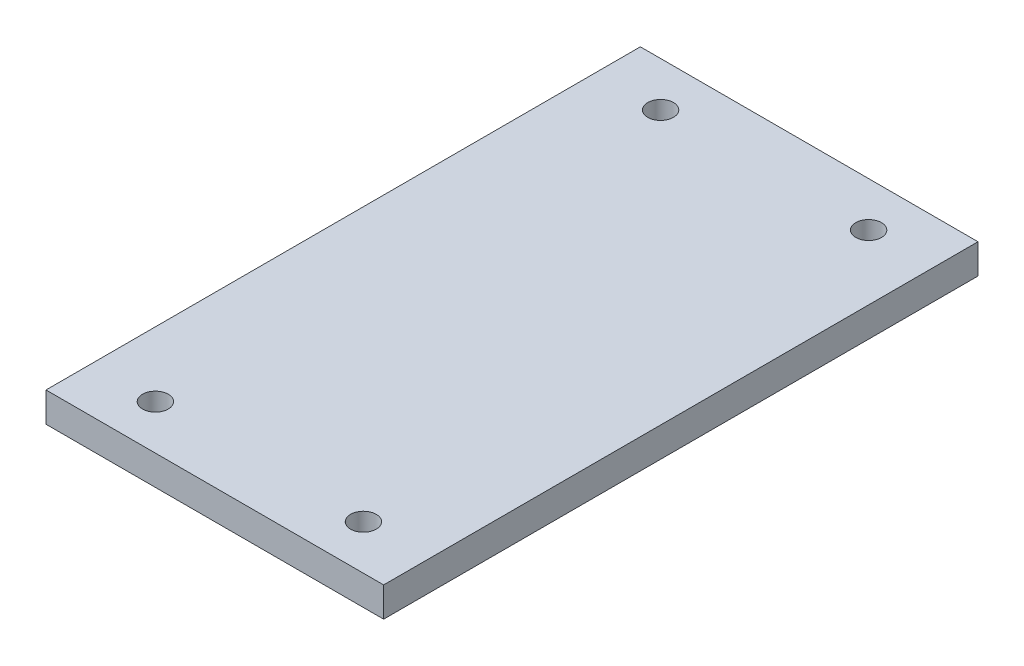
from build123d import *

# Parameters (mm, degrees)
SKETCH2_W           = 72.143718552
SKETCH2_H           = 127
BOSS_EXTRUDE1_DEPTH = 6.35
SKETCH3_R           = 2.75
CUT_EXTRUDE1_DEPTH  = 6.35


with BuildPart() as part:
    # Sketch2 → Boss-Extrude1 (new body)
    with BuildSketch(Plane(origin=(0, 0, 0), x_dir=(1, 0, 0), z_dir=(0, 1, 0))):
        Rectangle(SKETCH2_W, SKETCH2_H)
    extrude(amount=BOSS_EXTRUDE1_DEPTH)

    # Sketch3 → Cut-Extrude1 (cut)
    with BuildSketch(Plane(origin=(0, 6.35, 0), x_dir=(1, 0, 0), z_dir=(0, 1, 0))):
        with Locations(Location((-22.225, 53.975, 0), (0, 0, 270))):
            Circle(SKETCH3_R)
        with Locations(Location((22.225, 53.975, 0), (0, 0, 90))):
            Circle(SKETCH3_R)
        with Locations(Location((22.225, -53.975, 0), (0, 0, 270))):
            Circle(SKETCH3_R)
        with Locations(Location((-22.225, -53.975, 0), (0, 0, 90))):
            Circle(SKETCH3_R)
    extrude(amount=-CUT_EXTRUDE1_DEPTH, mode=Mode.SUBTRACT)


solid = part.part
